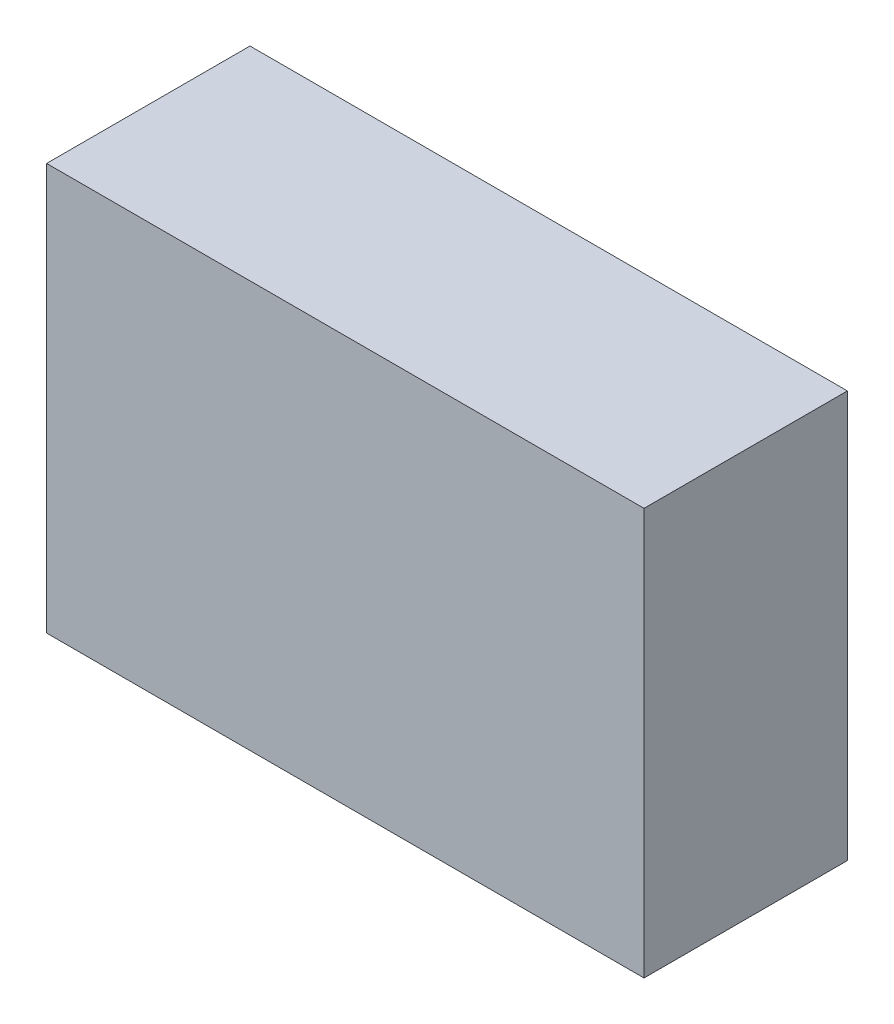
from build123d import *

# Parameters (mm, degrees)
SKETCH1_W           = 94
SKETCH1_H           = 64
BOSS_EXTRUDE1_DEPTH = 32


with BuildPart() as part:
    # Sketch1 → Boss-Extrude1 (new body)
    with BuildSketch(Plane.XY):
        Rectangle(SKETCH1_W, SKETCH1_H)
    extrude(amount=BOSS_EXTRUDE1_DEPTH)


solid = part.part
